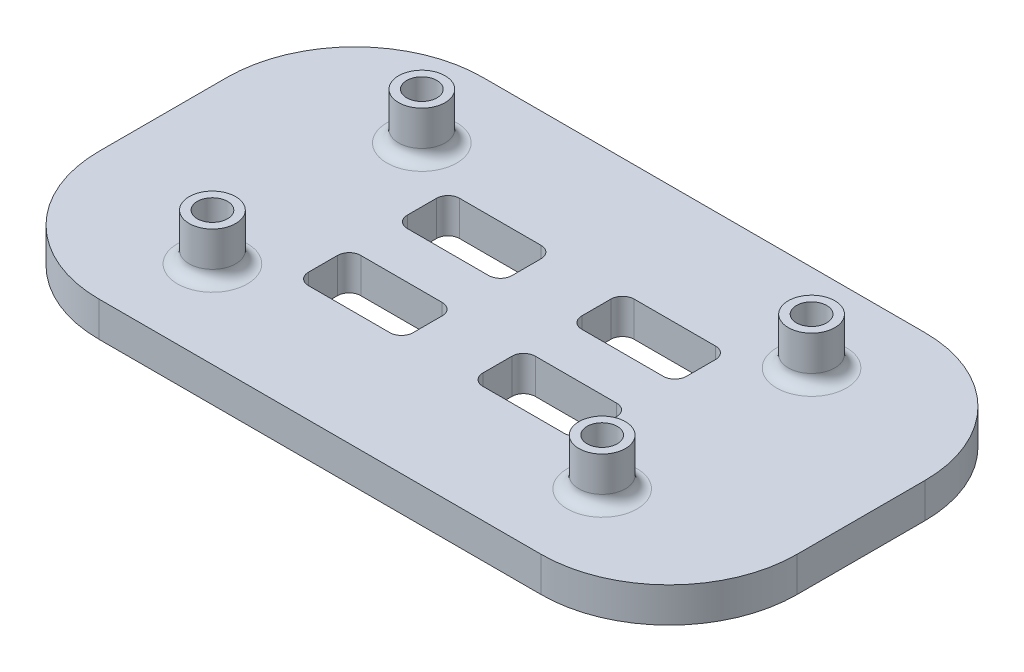
from build123d import *

# Parameters (mm, degrees)
SKETCH1_W           = 60
SKETCH1_H           = 33
BOSS_EXTRUDE1_DEPTH = 3
SKETCH2_R           = 1.3
CUT_EXTRUDE1_DEPTH  = 3
BOSS_EXTRUDE2_START = 4
SKETCH3_R           = 2
SKETCH3_R_2         = 1.3
BOSS_EXTRUDE2_DEPTH = 4
FILLET1_R           = 1
CUT_EXTRUDE2_DEPTH  = 2
FILLET2_R           = 11
SKETCH5_W           = 9
SKETCH5_H           = 4.5
CUT_EXTRUDE3_DEPTH  = 35.471002306
FILLET3_R           = 1


with BuildPart() as part:
    # Sketch1 → Boss-Extrude1 (new body)
    with BuildSketch(Plane(origin=(0, 0, 0), x_dir=(1, 0, 0), z_dir=(0, 1, 0))):
        Rectangle(SKETCH1_W, SKETCH1_H)
    extrude(amount=BOSS_EXTRUDE1_DEPTH)

    # Sketch2 → Cut-Extrude1 (cut)
    with BuildSketch(Plane(origin=(0, 3, 0), x_dir=(1, 0, 0), z_dir=(0, 1, 0))):
        with Locations(Location((-16.75, 9, 0), (0, 0, 270))):
            Circle(SKETCH2_R)
        with Locations(Location((16.75, 9, 0), (0, 0, 270))):
            Circle(SKETCH2_R)
        with Locations(Location((-16.75, -9, 0), (0, 0, 270))):
            Circle(SKETCH2_R)
        with Locations(Location((16.75, -9, 0), (0, 0, 270))):
            Circle(SKETCH2_R)
    extrude(amount=-CUT_EXTRUDE1_DEPTH, mode=Mode.SUBTRACT)

    # Sketch3 → Boss-Extrude2 (add)
    # profile 1 of 4: a face of its own
    with BuildSketch(Plane(origin=(0, 3, 0), x_dir=(1, 0, 0), z_dir=(0, 1, 0)).offset(BOSS_EXTRUDE2_START)):
        with Locations(Location((-16.75, 9, 0), (0, 0, 270))):
            Circle(SKETCH3_R)
        with Locations(Location((-16.75, 9, 0), (0, 0, 270))):
            Circle(SKETCH3_R_2, mode=Mode.SUBTRACT)
    # profile 2 of 4: a face of its own
    with BuildSketch(Plane(origin=(0, 3, 0), x_dir=(1, 0, 0), z_dir=(0, 1, 0)).offset(BOSS_EXTRUDE2_START)):
        with Locations(Location((-16.75, -9, 0), (0, 0, 270))):
            Circle(SKETCH3_R)
        with Locations(Location((-16.75, -9, 0), (0, 0, 270))):
            Circle(SKETCH3_R_2, mode=Mode.SUBTRACT)
    # profile 3 of 4: a face of its own
    with BuildSketch(Plane(origin=(0, 3, 0), x_dir=(1, 0, 0), z_dir=(0, 1, 0)).offset(BOSS_EXTRUDE2_START)):
        with Locations(Location((16.75, -9, 0), (0, 0, 270))):
            Circle(SKETCH3_R)
        with Locations(Location((16.75, -9, 0), (0, 0, 270))):
            Circle(SKETCH3_R_2, mode=Mode.SUBTRACT)
    # profile 4 of 4: a face of its own
    with BuildSketch(Plane(origin=(0, 3, 0), x_dir=(1, 0, 0), z_dir=(0, 1, 0)).offset(BOSS_EXTRUDE2_START)):
        with Locations(Location((16.75, 9, 0), (0, 0, 270))):
            Circle(SKETCH3_R)
        with Locations(Location((16.75, 9, 0), (0, 0, 270))):
            Circle(SKETCH3_R_2, mode=Mode.SUBTRACT)
    extrude(amount=-BOSS_EXTRUDE2_DEPTH)

    # Fillet1
    fillet1_edges = [part.edges().sort_by_distance(p)[0] for p in [
        (-16.75, 3, -11),
        (-16.75, 3, 7),
        (16.75, 3, 7),
        (16.75, 3, -11),
    ]]
    fillet(fillet1_edges, radius=FILLET1_R)

    # Sketch4 → Cut-Extrude2 (cut)
    with BuildSketch(Plane.XZ):
        Polygon((-15.508696921, 6.85), (-14.267393842, 9), (-15.508696921, 11.15), (-17.991303079, 11.15), (-19.232606158, 9), (-17.991303079, 6.85), align=None)
        Polygon((17.991303079, 6.85), (15.508696921, 6.85), (14.267393842, 9), (15.508696921, 11.15), (17.991303079, 11.15), (19.232606158, 9), align=None)
        Polygon((15.508696921, -6.85), (14.267393842, -9), (15.508696921, -11.15), (17.991303079, -11.15), (19.232606158, -9), (17.991303079, -6.85), align=None)
        Polygon((-17.991303079, -6.85), (-15.508696921, -6.85), (-14.267393842, -9), (-15.508696921, -11.15), (-17.991303079, -11.15), (-19.232606158, -9), align=None)
    extrude(amount=-CUT_EXTRUDE2_DEPTH, mode=Mode.SUBTRACT)

    # Fillet2
    fillet2_edges = [part.edges().sort_by_distance(p)[0] for p in [
        (-30, 1.5, -16.5),
        (30, 1.5, -16.5),
        (30, 1.5, 16.5),
        (-30, 1.5, 16.5),
    ]]
    fillet(fillet2_edges, radius=FILLET2_R)

    # Sketch5 → Cut-Extrude3 (cut, through all)
    with BuildSketch(Plane(origin=(0, 3, 0), x_dir=(1, 0, 0), z_dir=(0, 1, 0))):
        with Locations((-7.5, 4.25)):
            Rectangle(SKETCH5_W, SKETCH5_H)
        with Locations((7.5, 4.25)):
            Rectangle(SKETCH5_W, SKETCH5_H)
        with Locations((7.5, -4.25)):
            Rectangle(SKETCH5_W, SKETCH5_H)
        with Locations((-7.5, -4.25)):
            Rectangle(SKETCH5_W, SKETCH5_H)
    extrude(amount=-CUT_EXTRUDE3_DEPTH, mode=Mode.SUBTRACT)

    # Fillet3
    fillet3_edges = [part.edges().sort_by_distance(p)[0] for p in [
        (-12, 1.5, -2),
        (-12, 1.5, -6.5),
        (-3, 1.5, -6.5),
        (-3, 1.5, -2),
        (3, 1.5, -6.5),
        (12, 1.5, -6.5),
        (12, 1.5, -2),
        (3, 1.5, -2),
        (12, 1.5, 2),
        (12, 1.5, 6.5),
        (3, 1.5, 6.5),
        (3, 1.5, 2),
        (-3, 1.5, 6.5),
        (-12, 1.5, 6.5),
        (-12, 1.5, 2),
        (-3, 1.5, 2),
    ]]
    fillet(fillet3_edges, radius=FILLET3_R)


solid = part.part
